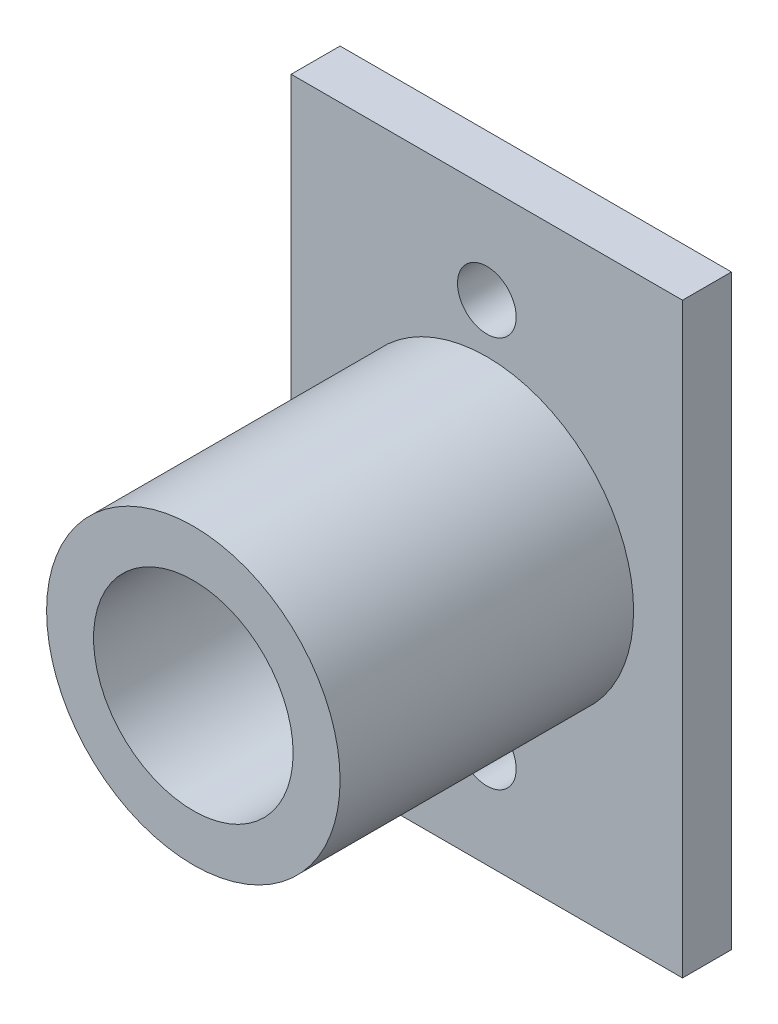
from build123d import *

# Parameters (mm, degrees)
SKETCH1_W           = 25.4
SKETCH1_H           = 38.1
BOSS_EXTRUDE1_DEPTH = 3.175
SKETCH2_R           = 9.525
BOSS_EXTRUDE2_DEPTH = 19.05
SKETCH3_R           = 6.477
CUT_EXTRUDE1_DEPTH  = 32.908355097
SKETCH4_R           = 1.905
CUT_EXTRUDE2_DEPTH  = 30.784140075


with BuildPart() as part:
    # Sketch1 → Boss-Extrude1 (new body)
    with BuildSketch(Plane.XY):
        Rectangle(SKETCH1_W, SKETCH1_H)
    extrude(amount=BOSS_EXTRUDE1_DEPTH)

    # Sketch2 → Boss-Extrude2 (add)
    with BuildSketch(Plane.XY.offset(3.175)):
        with Locations(Location((0, 0, 0), (0, 0, 180))):
            Circle(SKETCH2_R)
    extrude(amount=BOSS_EXTRUDE2_DEPTH)

    # Sketch3 → Cut-Extrude1 (cut, through all)
    with BuildSketch(Plane.XY.offset(22.225)):
        Circle(SKETCH3_R)
    extrude(amount=-CUT_EXTRUDE1_DEPTH, mode=Mode.SUBTRACT)

    # Sketch4 → Cut-Extrude2 (cut, through all)
    with BuildSketch(Plane.XY.offset(3.175)):
        with Locations((0, 12.7)):
            Circle(SKETCH4_R)
        with Locations((0, -12.7)):
            Circle(SKETCH4_R)
    extrude(amount=-CUT_EXTRUDE2_DEPTH, mode=Mode.SUBTRACT)


solid = part.part
